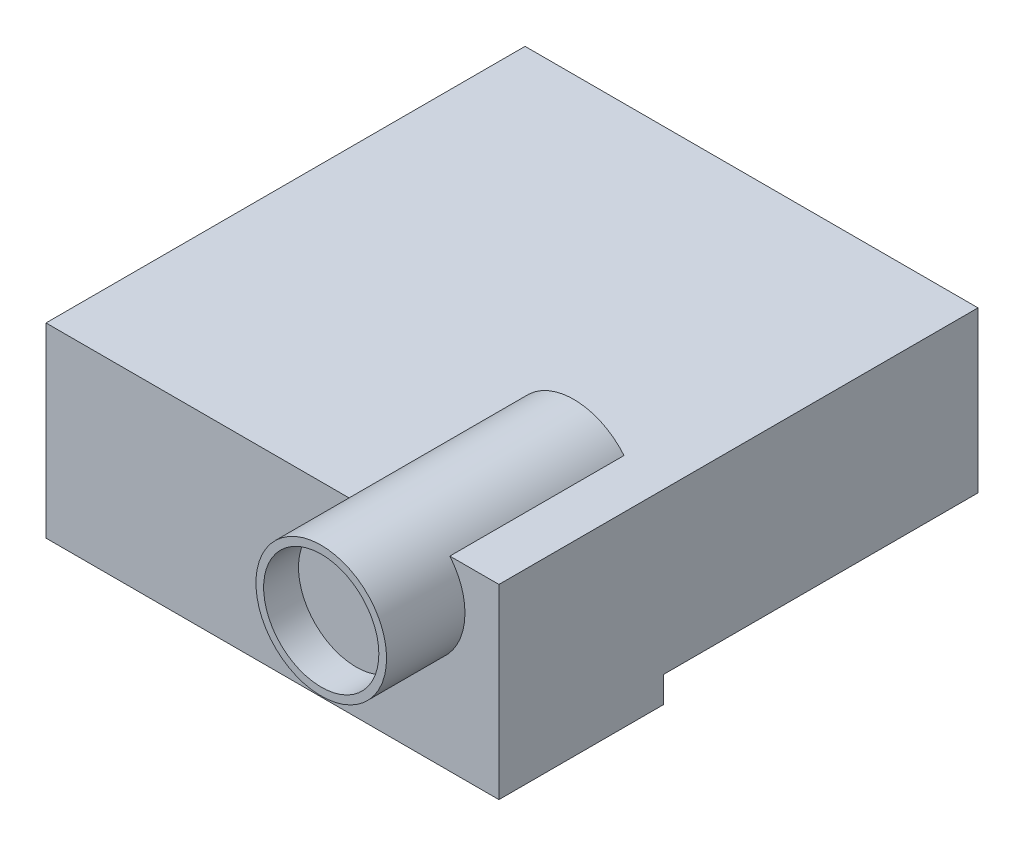
from build123d import *

# Parameters (mm, degrees)
SKETCH_1_W             = 260
SKETCH_1_H             = 275
EXTRUDE_1_DEPTH        = 107
EXTRUDE_2_DEPTH        = 25
EXTRUDE_2_DEPTH_BACK   = 100
SKETCH_2_R             = 37.5
SKETCH_3_W             = 180.515861549
SKETCH_3_H             = 15
CUT_EXTRUDE_1_DEPTH    = 398.171562426
M4X0_7_1_D             = 3.3
M4X0_7_1_DEPTH         = 11.5
M4X0_7_1_TIP           = 0.991420021
SKETCH_17_R            = 37.5
SKETCH_17_R_2          = 33.067386868
EXTRUDE_4_DEPTH        = 20
HOLE_WIZARD_M4_1_D     = 4.5
HOLE_WIZARD_M4_1_DEPTH = 20
HOLE_WIZARD_M4_1_TIP   = 1.351936393


with BuildPart() as part:
    # Sketch 1 → 보스-돌출1 (new body)
    with BuildSketch(Plane(origin=(0, 0, 0), x_dir=(1, 0, 0), z_dir=(0, 1, 0))):
        with Locations((130, 137.5)):
            Rectangle(SKETCH_1_W, SKETCH_1_H)
    extrude(amount=EXTRUDE_1_DEPTH)

    # Sketch 2 → 보스-돌출2 (add, two sides: drawn at the far end of the back side and taken through both)
    with BuildSketch(Plane.XY.offset(-EXTRUDE_2_DEPTH_BACK)):
        with Locations((203, 83)):
            Circle(SKETCH_2_R)
    extrude(amount=EXTRUDE_2_DEPTH + EXTRUDE_2_DEPTH_BACK)

    # 스케치3 → 컷-돌출1 (cut, through all)
    with BuildSketch(Plane(origin=(260, 0, 0), x_dir=(0, 0, -1), z_dir=(1, 0, 0))):
        with Locations((184.742069226, 7.5)):
            Rectangle(SKETCH_3_W, SKETCH_3_H)
    extrude(amount=-CUT_EXTRUDE_1_DEPTH, mode=Mode.SUBTRACT)

    # M4x0.7 나사 구멍1
    with Locations(Plane(origin=(0, 15, 0), x_dir=(-1, 0, 0), z_dir=(0, -1, 0))):
        with Locations((-36, 235), (-209, 235)):
            Hole(M4X0_7_1_D / 2, depth=M4X0_7_1_DEPTH)
            with Locations((0, 0, -(M4X0_7_1_DEPTH + M4X0_7_1_TIP / 2))):  # 118° drill point
                Cone(0, M4X0_7_1_D / 2, M4X0_7_1_TIP, mode=Mode.SUBTRACT)

    # 스케치17 → 보스-돌출4 (add)
    with BuildSketch(Plane.XY.offset(25)):
        with Locations((203, 83)):
            Circle(SKETCH_17_R)
        with Locations((203, 83)):
            Circle(SKETCH_17_R_2, mode=Mode.SUBTRACT)
    extrude(amount=EXTRUDE_4_DEPTH)

    # M4 여유 구멍1
    with Locations(Plane(origin=(0, 0, 0), x_dir=(-1, 0, 0), z_dir=(0, -1, 0))):
        with Locations((-143.933526012, 49.055508383)):
            Hole(HOLE_WIZARD_M4_1_D / 2, depth=HOLE_WIZARD_M4_1_DEPTH)
            with Locations((0, 0, -(HOLE_WIZARD_M4_1_DEPTH + HOLE_WIZARD_M4_1_TIP / 2))):  # 118° drill point
                Cone(0, HOLE_WIZARD_M4_1_D / 2, HOLE_WIZARD_M4_1_TIP, mode=Mode.SUBTRACT)


solid = part.part
